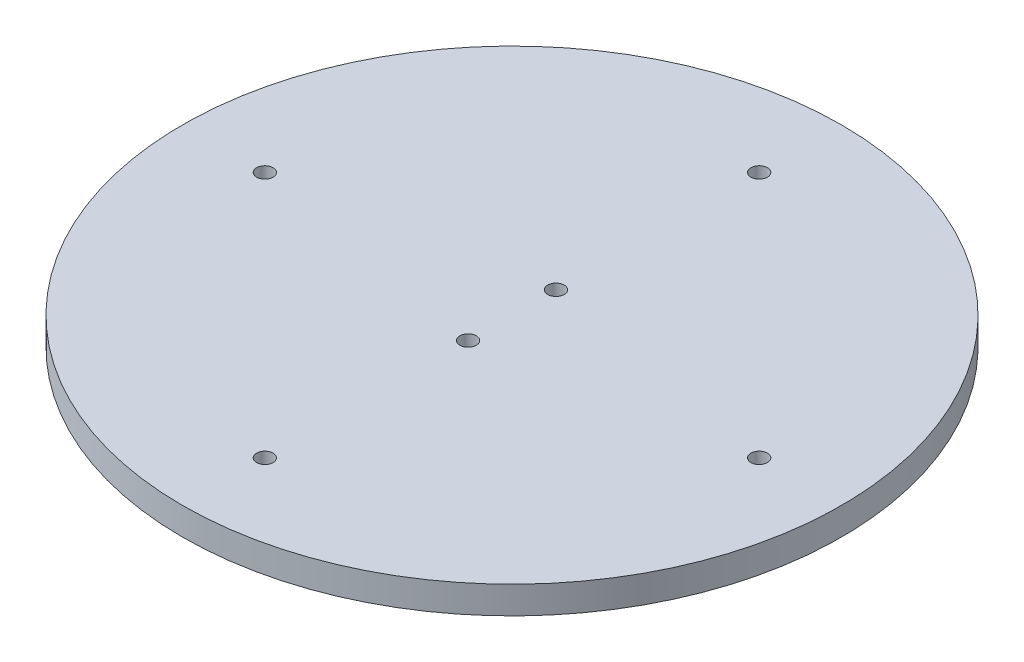
from build123d import *

# Parameters (mm, degrees)
SKETCH1_R           = 60
BOSS_EXTRUDE1_DEPTH = 5
SKETCH2_R           = 1.5
CUT_EXTRUDE1_DEPTH  = 5
CUT_EXTRUDE2_REACH  = 87
SKETCH3_R           = 1.5


with BuildPart() as part:
    # Sketch1 → Boss-Extrude1 (new body)
    with BuildSketch(Plane(origin=(0, 0, 0), x_dir=(1, 0, 0), z_dir=(0, 1, 0))):
        with Locations(Location((0, 0, 0), (0, 0, 270))):
            Circle(SKETCH1_R)
    extrude(amount=BOSS_EXTRUDE1_DEPTH)

    # Sketch2 → Cut-Extrude1 (cut)
    with BuildSketch(Plane(origin=(0, 5, 0), x_dir=(1, 0, 0), z_dir=(0, 1, 0))):
        with Locations(Location((45, 0, 0), (0, 0, 270))):
            Circle(SKETCH2_R)
        with Locations(Location((0, -45, 0), (0, 0, 270))):
            Circle(SKETCH2_R)
        with Locations(Location((-45, 0, 0), (0, 0, 270))):
            Circle(SKETCH2_R)
        with Locations(Location((0, 45, 0), (0, 0, 270))):
            Circle(SKETCH2_R)
    extrude(amount=-CUT_EXTRUDE1_DEPTH, mode=Mode.SUBTRACT)

    # Sketch3 → Cut-Extrude2 (cut, up to next)
    with BuildSketch(Plane(origin=(0, 5, 0), x_dir=(1, 0, 0), z_dir=(0, 1, 0)), mode=Mode.PRIVATE) as cut_extrude2_sk1:
        with Locations(Location((0, -8, 0), (0, 0, 270))):
            Circle(SKETCH3_R)
    cut_extrude2_tool1 = extrude(cut_extrude2_sk1.sketch, amount=-CUT_EXTRUDE2_REACH, mode=Mode.PRIVATE) & part.part
    # Sketch3 → Cut-Extrude2 (cut, up to next)
    with BuildSketch(Plane(origin=(0, 5, 0), x_dir=(1, 0, 0), z_dir=(0, 1, 0)), mode=Mode.PRIVATE) as cut_extrude2_sk2:
        with Locations(Location((0, 8, 0), (0, 0, 270))):
            Circle(SKETCH3_R)
    cut_extrude2_tool2 = extrude(cut_extrude2_sk2.sketch, amount=-CUT_EXTRUDE2_REACH, mode=Mode.PRIVATE) & part.part
    add(cut_extrude2_tool1.solids().sort_by_distance((0, 5, 8))[0], mode=Mode.SUBTRACT)
    add(cut_extrude2_tool2.solids().sort_by_distance((0, 5, -8))[0], mode=Mode.SUBTRACT)


solid = part.part
